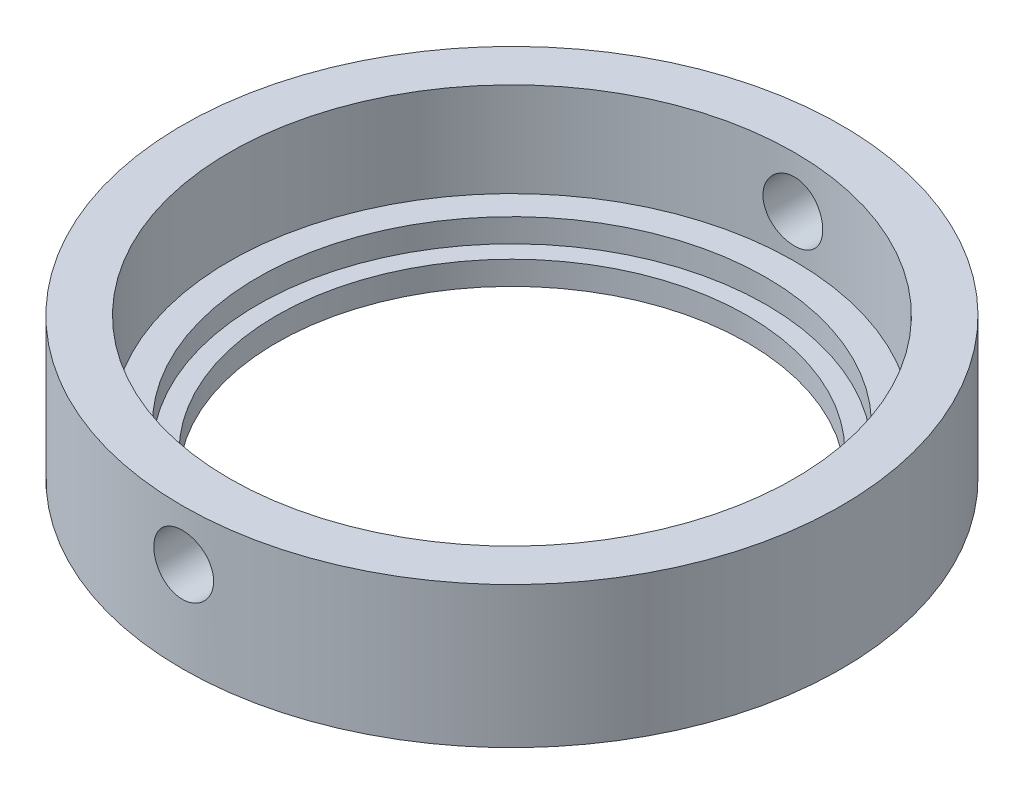
from build123d import *

# Parameters (mm, degrees)
SKETCH1_R               = 35
BOSS_EXTRUDE1_DEPTH     = 25
SKETCH2_R               = 30
CUT_EXTRUDE1_DEPTH      = 20
SKETCH3_R               = 25
CUT_EXTRUDE2_DEPTH      = 20
SKETCH4_R               = 27
CUT_EXTRUDE3_DEPTH      = 2.5
SKETCH5_R               = 55.910187051
CUT_EXTRUDE4_DEPTH      = 10
CUT_EXTRUDE6_DEPTH      = 52.720402164
CUT_EXTRUDE6_DEPTH_BACK = 52.720402164
SKETCH7_R               = 3.175


with BuildPart() as part:
    # Sketch1 → Boss-Extrude1 (new body)
    with BuildSketch(Plane(origin=(0, 0, 0), x_dir=(1, 0, 0), z_dir=(0, 1, 0))):
        with Locations(Location((0, 0, 0), (0, 0, 270))):
            Circle(SKETCH1_R)
    extrude(amount=BOSS_EXTRUDE1_DEPTH)

    # Sketch2 → Cut-Extrude1 (cut)
    with BuildSketch(Plane(origin=(0, 25, 0), x_dir=(1, 0, 0), z_dir=(0, 1, 0))):
        with Locations(Location((0, 0, 0), (0, 0, 270))):
            Circle(SKETCH2_R)
    extrude(amount=-CUT_EXTRUDE1_DEPTH, mode=Mode.SUBTRACT)

    # Sketch3 → Cut-Extrude2 (cut)
    with BuildSketch(Plane.XZ):
        with Locations(Location((0, 0, 0), (0, 0, 270))):
            Circle(SKETCH3_R)
    extrude(amount=-CUT_EXTRUDE2_DEPTH, mode=Mode.SUBTRACT)

    # Sketch4 → Cut-Extrude3 (cut)
    with BuildSketch(Plane(origin=(0, 5, 0), x_dir=(1, 0, 0), z_dir=(0, 1, 0))):
        with Locations(Location((0, 0, 0), (0, 0, 270))):
            Circle(SKETCH4_R)
    extrude(amount=-CUT_EXTRUDE3_DEPTH, mode=Mode.SUBTRACT)

    # Sketch5 → Cut-Extrude4 (cut)
    with BuildSketch(Plane(origin=(0, 25, 0), x_dir=(1, 0, 0), z_dir=(0, 1, 0))):
        Circle(SKETCH5_R)
    extrude(amount=-CUT_EXTRUDE4_DEPTH, mode=Mode.SUBTRACT)

    # Sketch7 → Cut-Extrude6 (cut, two sides: drawn at the far end of the back side and taken through both)
    with BuildSketch(Plane.XY.offset(-CUT_EXTRUDE6_DEPTH_BACK)):
        with Locations((0, 9.572)):
            Circle(SKETCH7_R)
    extrude(amount=CUT_EXTRUDE6_DEPTH + CUT_EXTRUDE6_DEPTH_BACK, mode=Mode.SUBTRACT)


solid = part.part
